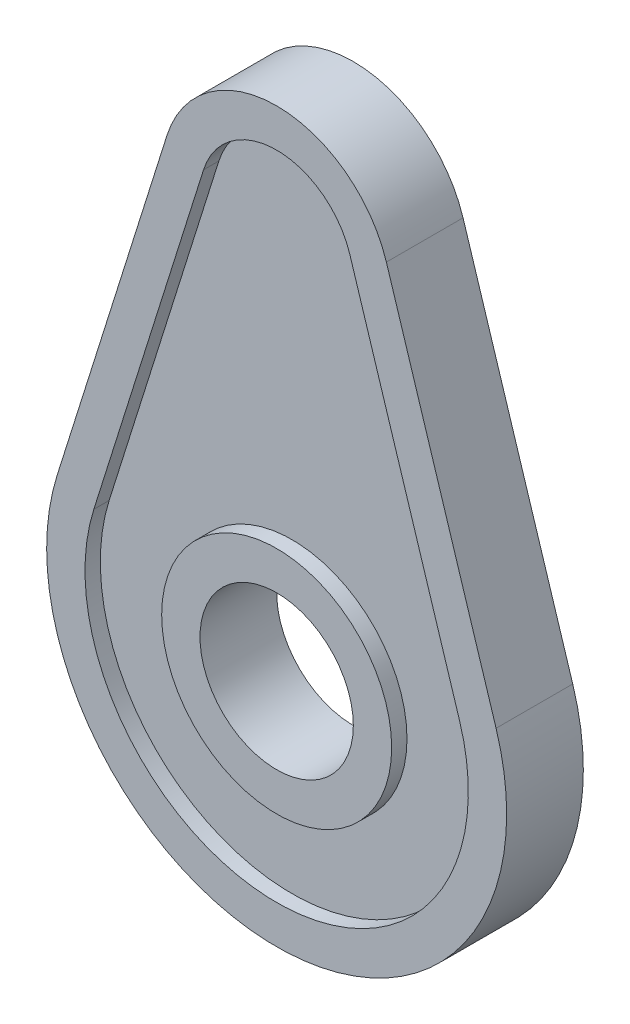
from build123d import *

# Parameters (mm, degrees)
SKETCH1_R           = 10
BOSS_EXTRUDE1_DEPTH = 10
SKETCH2_R           = 15
CUT_EXTRUDE1_DEPTH  = 2


with BuildPart() as part:
    # Sketch1 → Boss-Extrude1 (new body)
    with BuildSketch(Plane.XY):
        with BuildLine():
            Line((-14.309088021, 54.5), (-28.618176043, 9))
            ThreePointArc((-28.618176043, 9), (0, -30), (28.618176043, 9))
            Line((28.618176043, 9), (14.309088021, 54.5))
            ThreePointArc((14.309088021, 54.5), (0, 65), (-14.309088021, 54.5))
        make_face()
        Circle(SKETCH1_R, mode=Mode.SUBTRACT)
    extrude(amount=BOSS_EXTRUDE1_DEPTH)

    # Sketch2 → Cut-Extrude1 (cut)
    with BuildSketch(Plane.XY.offset(10)):
        with BuildLine():
            Line((23.848480035, 7.5), (9.539392014, 53))
            ThreePointArc((9.539392014, 53), (0, 60), (-9.539392014, 53))
            Line((-9.539392014, 53), (-23.848480035, 7.5))
            ThreePointArc((-23.848480035, 7.5), (0, -25), (23.848480035, 7.5))
        make_face()
        Circle(SKETCH2_R, mode=Mode.SUBTRACT)
    cut_extrude1 = extrude(amount=-CUT_EXTRUDE1_DEPTH, mode=Mode.SUBTRACT)

    # Mirror1: Cut-Extrude1 across plane
    add(cut_extrude1.mirror(Plane.XY.offset(5)), mode=Mode.SUBTRACT)


solid = part.part
